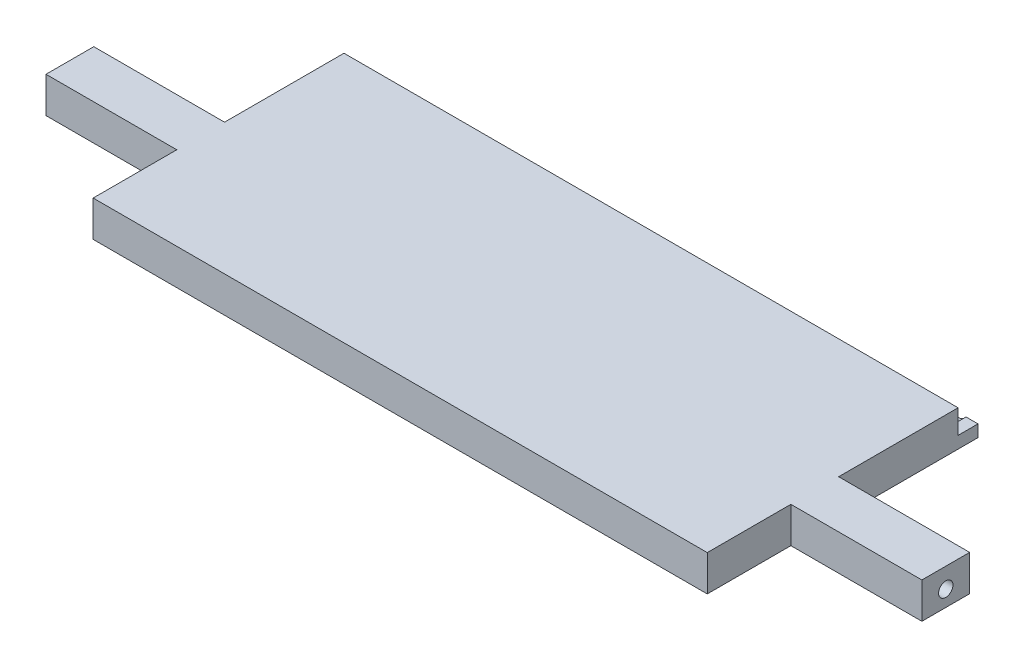
from build123d import *

# Parameters (mm, degrees)
SKETCH_1_W          = 220
SKETCH_1_H          = 9
SKETCH_1_R          = 2.6
EXTRUDE_1_DEPTH     = 65
SKETCH_2_W          = 220
SKETCH_2_H          = 5
CUT_EXTRUDE_1_DEPTH = 6
SKETCH_3_W          = 32.846323942
SKETCH_3_H          = 35
SKETCH_3_H_2        = 18
SKETCH_3_W_2        = 32.906323942
CUT_EXTRUDE_2_DEPTH = 230.577873498
SKETCH_4_R          = 1.8
CUT_EXTRUDE_3_DEPTH = 10
CUT_EXTRUDE_START   = -10
SKETCH_5_R          = 1.8
CUT_EXTRUDE_4_DEPTH = 10
SKETCH_6_W          = 154.247352116
SKETCH_6_H          = 9
EXTRUDE_2_DEPTH     = 3


with BuildPart() as part:
    # Эскиз1 → Бобышка-Вытянуть1 (new body)
    with BuildSketch(Plane.XY):
        with Locations((110, 4.5)):
            Rectangle(SKETCH_1_W, SKETCH_1_H)
        with Locations((37.97, 4.5)):
            Circle(SKETCH_1_R, mode=Mode.SUBTRACT)
        with Locations((55.97, 4.5)):
            Circle(SKETCH_1_R, mode=Mode.SUBTRACT)
        with Locations((73.97, 4.5)):
            Circle(SKETCH_1_R, mode=Mode.SUBTRACT)
        with Locations((91.97, 4.5)):
            Circle(SKETCH_1_R, mode=Mode.SUBTRACT)
        with Locations((109.97, 4.5)):
            Circle(SKETCH_1_R, mode=Mode.SUBTRACT)
        with Locations((127.97, 4.5)):
            Circle(SKETCH_1_R, mode=Mode.SUBTRACT)
        with Locations((145.97, 4.5)):
            Circle(SKETCH_1_R, mode=Mode.SUBTRACT)
        with Locations((163.97, 4.5)):
            Circle(SKETCH_1_R, mode=Mode.SUBTRACT)
        with Locations((181.97, 4.5)):
            Circle(SKETCH_1_R, mode=Mode.SUBTRACT)
    extrude(amount=EXTRUDE_1_DEPTH)

    # Эскиз2 → Вырез-Вытянуть1 (cut)
    with BuildSketch(Plane(origin=(0, 9, 0), x_dir=(1, 0, 0), z_dir=(0, 1, 0))):
        with Locations((110, -2.5)):
            Rectangle(SKETCH_2_W, SKETCH_2_H)
    extrude(amount=-CUT_EXTRUDE_1_DEPTH, mode=Mode.SUBTRACT)

    # Эскиз3 → Вырез-Вытянуть2 (cut, through all)
    with BuildSketch(Plane(origin=(0, 9, 0), x_dir=(1, 0, 0), z_dir=(0, 1, 0))):
        with Locations((16.423161971, -17.5)):
            Rectangle(SKETCH_3_W, SKETCH_3_H)
        with Locations((16.423161971, -56)):
            Rectangle(SKETCH_3_W, SKETCH_3_H_2)
        with Locations((203.546838029, -17.5)):
            Rectangle(SKETCH_3_W_2, SKETCH_3_H)
        with Locations((203.546838029, -56)):
            Rectangle(SKETCH_3_W_2, SKETCH_3_H_2)
    extrude(amount=-CUT_EXTRUDE_2_DEPTH, mode=Mode.SUBTRACT)

    # Эскиз4 → Вырез-Вытянуть3 (cut)
    with BuildSketch(Plane.ZY):
        with Locations((41, 4)):
            Circle(SKETCH_4_R)
    extrude(amount=-CUT_EXTRUDE_3_DEPTH, mode=Mode.SUBTRACT)

    # Эскиз5 → Вырез-Вытянуть4 (cut)
    with BuildSketch(Plane(origin=(220, 0, 0), x_dir=(0, 0, -1), z_dir=(1, 0, 0)).offset(CUT_EXTRUDE_START)):
        with Locations(Location((-41, 4, 0), (0, 0, 180))):
            Circle(SKETCH_5_R)
    extrude(amount=CUT_EXTRUDE_4_DEPTH, mode=Mode.SUBTRACT)

    # Эскиз6 → Бобышка-Вытянуть2 (add)
    with BuildSketch(Plane.XY.offset(65)):
        with Locations((109.97, 4.5)):
            Rectangle(SKETCH_6_W, SKETCH_6_H)
    extrude(amount=EXTRUDE_2_DEPTH)


solid = part.part
